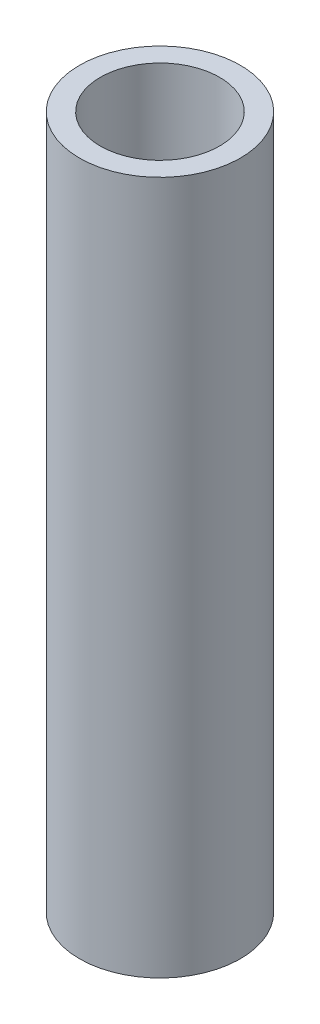
from build123d import *

# Parameters (mm, degrees)
SKETCH1_R           = 5.8
SKETCH1_R_2         = 4.3
BOSS_EXTRUDE2_DEPTH = 50


with BuildPart() as part:
    # Sketch1 → Boss-Extrude2 (new body)
    with BuildSketch(Plane(origin=(0, 0, 0), x_dir=(1, 0, 0), z_dir=(0, 1, 0))):
        with Locations(Location((0, 0, 0), (0, 0, 270))):
            Circle(SKETCH1_R)
        with Locations(Location((0, 0, 0), (0, 0, 270))):
            Circle(SKETCH1_R_2, mode=Mode.SUBTRACT)
    extrude(amount=BOSS_EXTRUDE2_DEPTH)


solid = part.part
